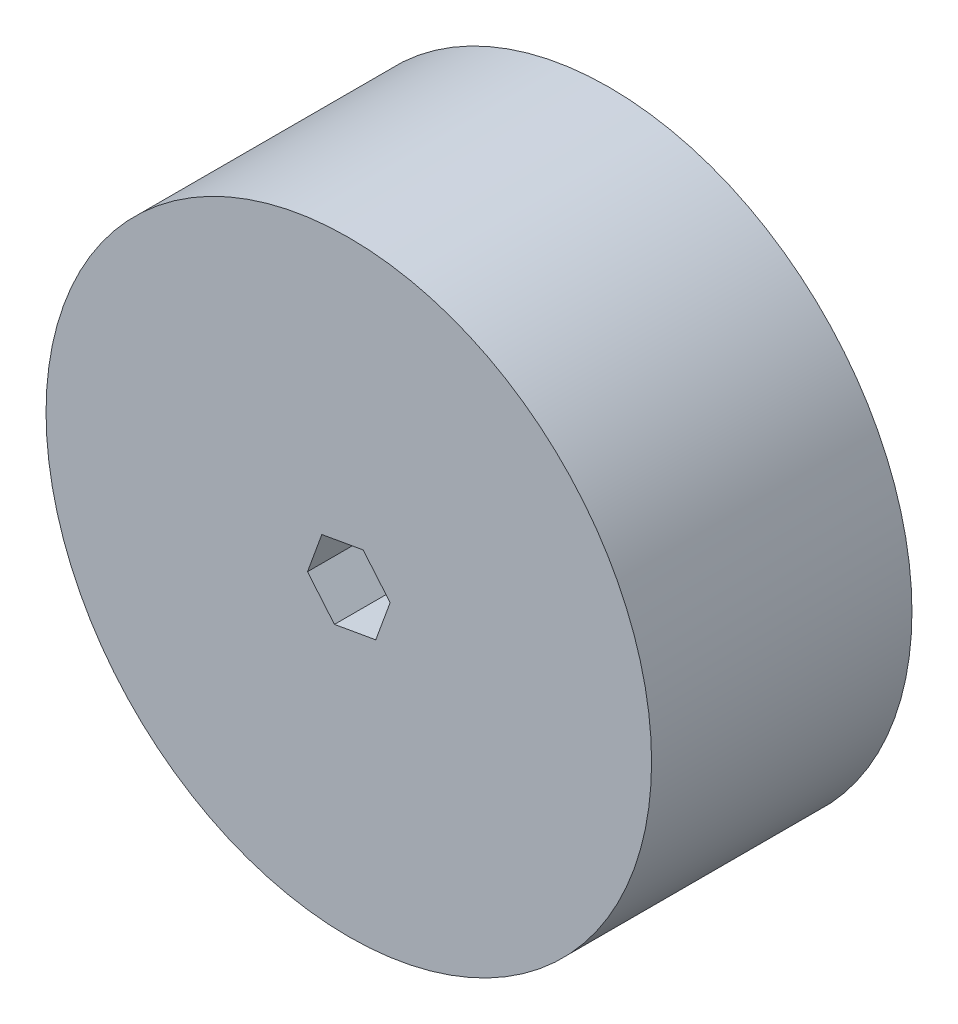
from build123d import *

# Parameters (mm, degrees)
SKETCH_1_R          = 50
EXTRUDE_1_DEPTH     = 43
CUT_EXTRUDE_1_DEPTH = 25


with BuildPart() as part:
    # 草图1 → 凸台-拉伸1 (new body)
    with BuildSketch(Plane.XY):
        Circle(SKETCH_1_R)
    extrude(amount=EXTRUDE_1_DEPTH)

    # 草图2 → 切除-拉伸1 (cut)
    with BuildSketch(Plane.XY.offset(43)):
        Polygon((4.453137053, -5.307501332), (6.82299951, 1.202779148), (2.369862458, 6.51028048), (-4.453137053, 5.307501332), (-6.82299951, -1.202779148), (-2.369862458, -6.51028048), align=None)
    extrude(amount=-CUT_EXTRUDE_1_DEPTH, mode=Mode.SUBTRACT)


solid = part.part
